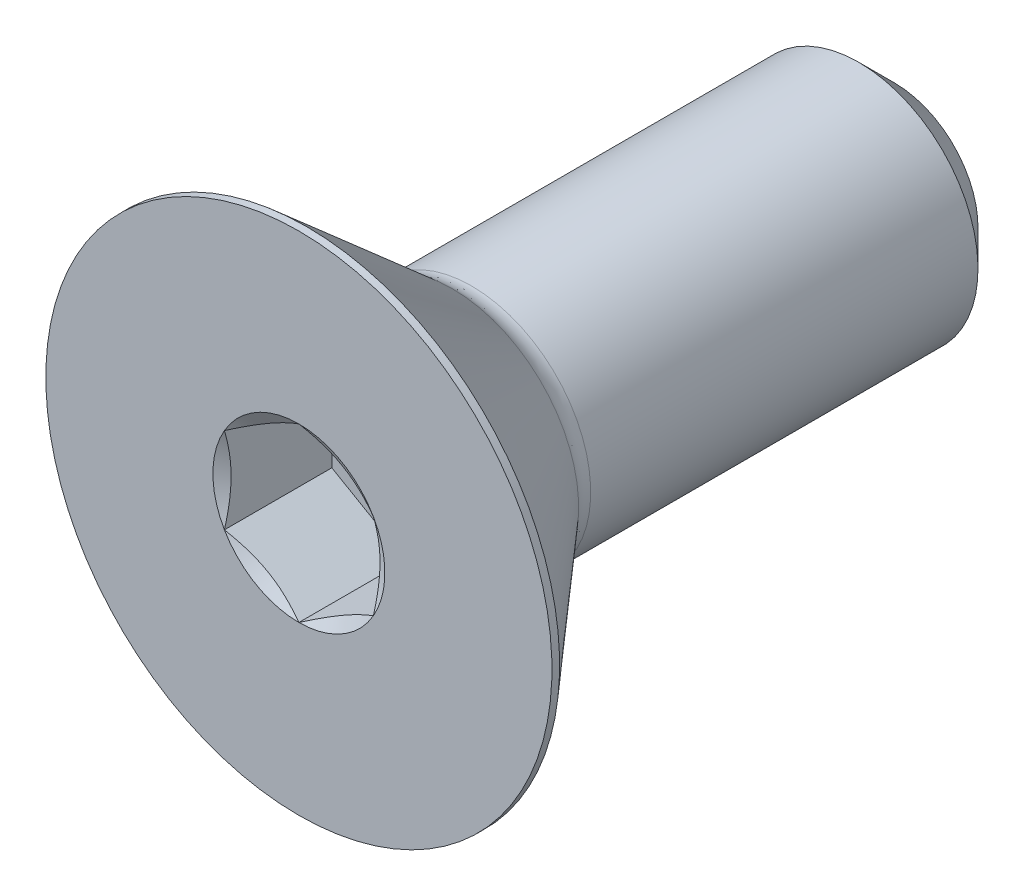
from build123d import *

# Parameters (mm, degrees)
SKETCH1_W          = 15.875
SKETCH1_H          = 3.175
CHAMFER1_SIZE      = 0.9525
CUT_EXTRUDE2_DEPTH = 2.86258


with BuildPart() as part:
    # Sketch1 → Revolve1 (revolve)
    with BuildSketch(Plane(origin=(0, 0, 0), x_dir=(0, 0, -1), z_dir=(1, 0, 0))):
        with Locations((7.9375, 1.5875)):
            Rectangle(SKETCH1_W, SKETCH1_H)
    revolve(axis=Axis((0, 0, -15.875), (0, 0, 1)))

    # Chamfer1
    chamfer1_edges = [part.edges().sort_by_distance(p)[0] for p in [
        (0, -3.175, -15.875),
    ]]
    chamfer(chamfer1_edges, length=CHAMFER1_SIZE)

    # Sketch7 → Revolve2 (revolve)
    with BuildSketch(Plane(origin=(0, 0, 0), x_dir=(0, 0, -1), z_dir=(1, 0, 0)), mode=Mode.PRIVATE) as revolve2_sk:
        with BuildLine():
            Line((0, 6.7437), (0.20447, 6.7437))
            Line((0.20447, 6.7437), (4.0894, 3.366581874))
            ThreePointArc((4.0894, 3.366581874), (4.328282675, 3.224461616), (4.601808997, 3.175))
            Line((4.601808997, 3.175), (4.601808997, 0))
            Line((4.601808997, 0), (0, 0))
            Line((0, 0), (0, 6.7437))
        make_face()
    revolve(revolve2_sk.sketch.rotate(Axis((0, 0, 0), (0, 0, -1)), 180), axis=Axis((0, 0, 0), (0, 0, -1)))

    # Boss-Extrude1 cone 1 section (through the dimple's axis) → Boss-Extrude1 (revolve)
    with BuildSketch(Plane(origin=(0, 0, -4.601808997), x_dir=(0, -1, 0), z_dir=(1, 0, 0))):
        Polygon((0, 0), (3.175, 0), (0, 3.06606186), align=None)
    revolve(axis=Axis((0, 0, -4.601808997), (0, 0, -1)))

    # Sketch5 → Cut-Extrude2 (cut)
    with BuildSketch(Plane.XY):
        Polygon((0, 2.291358881), (-1.984375, 1.14567944), (-1.984375, -1.14567944), (0, -2.291358881), (1.984375, -1.14567944), (1.984375, 1.14567944), align=None)
    extrude(amount=-CUT_EXTRUDE2_DEPTH, mode=Mode.SUBTRACT)

    # Cut-Extrude3 cone 1 section (through the dimple's axis) → Cut-Extrude3 (revolve, cut)
    with BuildSketch(Plane(origin=(0, 0, 0), x_dir=(0, -1, 0), z_dir=(1, 0, 0))):
        Polygon((0, 0), (2.291358881, 0), (0, 1.322916667), align=None)
    revolve(axis=Axis((0, 0, 0), (0, 0, -1)), mode=Mode.SUBTRACT)


solid = part.part
